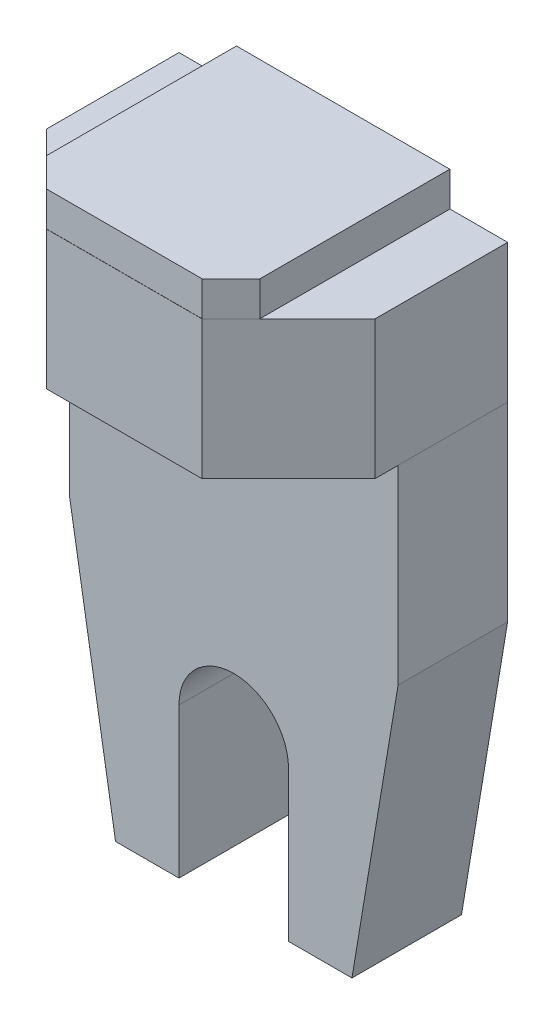
from build123d import *

# Parameters (mm, degrees)
SKETCH2_W           = 57
SKETCH2_H           = 105
BOSS_EXTRUDE1_DEPTH = 19
CUT_EXTRUDE1_DEPTH  = 19
CUT_EXTRUDE2_DEPTH  = 19
CUT_EXTRUDE3_DEPTH  = 63.685724053
BOSS_EXTRUDE2_DEPTH = 24
BOSS_EXTRUDE3_DEPTH = 6


with BuildPart() as part:
    # Sketch2 → Boss-Extrude1 (new body)
    with BuildSketch(Plane.XY):
        Rectangle(SKETCH2_W, SKETCH2_H)
    extrude(amount=BOSS_EXTRUDE1_DEPTH)

    # Sketch5 → Cut-Extrude1 (cut)
    with BuildSketch(Plane.XY.offset(19)):
        Polygon((28.5, -52.5), (20.5, -52.5), (28.5, -4.5), align=None)
    extrude(amount=-CUT_EXTRUDE1_DEPTH, mode=Mode.SUBTRACT)

    # Sketch6 → Cut-Extrude2 (cut)
    with BuildSketch(Plane.XY.offset(19)):
        Polygon((-28.5, -52.5), (-28.5, -4.5), (-20.5, -52.5), align=None)
    extrude(amount=-CUT_EXTRUDE2_DEPTH, mode=Mode.SUBTRACT)

    # Sketch7 → Cut-Extrude3 (cut, through all)
    with BuildSketch(Plane.XY.offset(19)):
        with BuildLine():
            Line((-9.5, -52.5), (-9.5, -26.5))
            ThreePointArc((-9.5, -26.5), (0, -17), (9.5, -26.5))
            Line((9.5, -26.5), (9.5, -52.5))
            Line((9.5, -52.5), (-9.5, -52.5))
        make_face()
    extrude(amount=-CUT_EXTRUDE3_DEPTH, mode=Mode.SUBTRACT)

    # Sketch9 → Boss-Extrude2 (add)
    with BuildSketch(Plane(origin=(0, 52.5, 0), x_dir=(1, 0, 0), z_dir=(0, 1, 0))):
        Polygon((-28.5, -23), (-13.5, -38), (13.501670398, -38), (28.501670398, -23), (28.501670398, 0), (-28.5, 0), align=None)
    extrude(amount=-BOSS_EXTRUDE2_DEPTH)

    # Sketch10 → Boss-Extrude3 (add)
    with BuildSketch(Plane(origin=(0, 52.5, 0), x_dir=(1, 0, 0), z_dir=(0, 1, 0))):
        Polygon((18.5, -0.029901303), (-18.5, -0.029901303), (-18.5, -32.973175132), (-13.5, -37.973175132), (13.5, -37.973175132), (18.5, -32.973175132), align=None)
    extrude(amount=BOSS_EXTRUDE3_DEPTH)


solid = part.part
